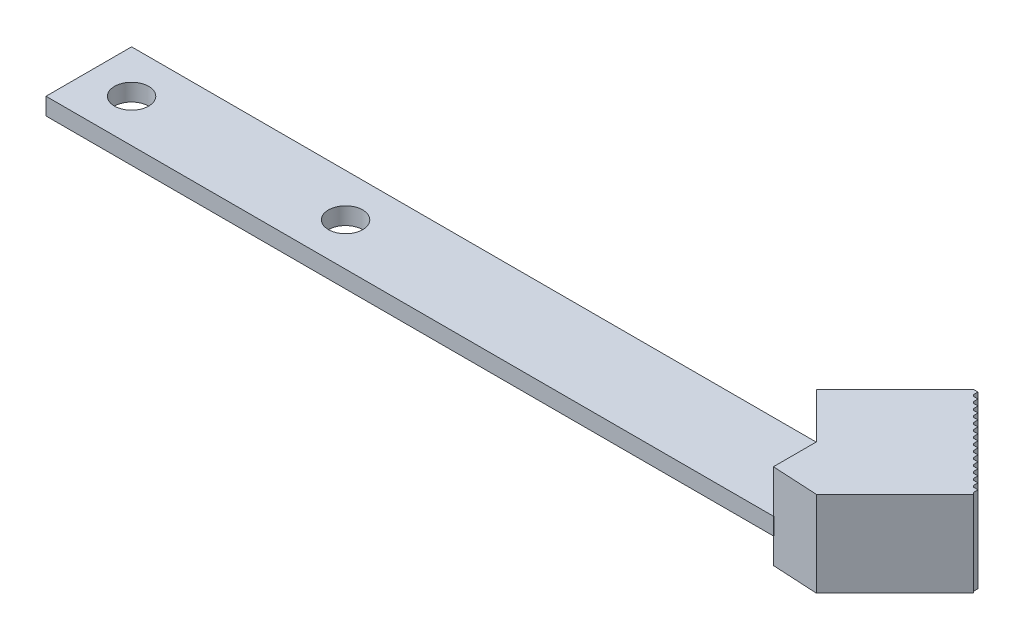
from build123d import *

# Parameters (mm, degrees)
SKETCH1_W           = 85
SKETCH1_H           = 10
SKETCH1_R           = 2
BOSS_EXTRUDE1_DEPTH = 2
CUT_EXTRUDE1_DEPTH  = 10
SKETCH3_W           = 15
SKETCH3_H           = 10
BOSS_EXTRUDE2_DEPTH = 13
BOSS_EXTRUDE3_DEPTH = 10
BOSS_EXTRUDE4_DEPTH = 10


with BuildPart() as part:
    # Sketch1 → Boss-Extrude1 (new body)
    with BuildSketch(Plane(origin=(0, 0, 0), x_dir=(1, 0, 0), z_dir=(0, 1, 0))):
        with Locations((18.270818553, 2.053936679)):
            Rectangle(SKETCH1_W, SKETCH1_H)
        with Locations(Location((-19.229181447, 2.053936679, 0), (0, 0, 270))):
            Circle(SKETCH1_R, mode=Mode.SUBTRACT)
        with Locations(Location((5.770818553, 2.053936679, 0), (0, 0, 270))):
            Circle(SKETCH1_R, mode=Mode.SUBTRACT)
    extrude(amount=BOSS_EXTRUDE1_DEPTH)

    # Sketch2 → Cut-Extrude1 (cut)
    with BuildSketch(Plane(origin=(0, 2, 0), x_dir=(1, 0, 0), z_dir=(0, 1, 0))):
        Polygon((55.770818553, 7.053936679), (60.770818553, 2.053936679), (60.770818553, 7.053936679), align=None)
    extrude(amount=-CUT_EXTRUDE1_DEPTH, mode=Mode.SUBTRACT)

    # Sketch3 → Boss-Extrude2 (add)
    with BuildSketch(Plane(origin=(31.412377616, 0, -31.412377616), x_dir=(-0.7071067811865488, 0, -0.7071067811865462), z_dir=(0.7071067811865462, 0, -0.7071067811865488))):
        with Locations((-41.420324571, 1.952612945)):
            Rectangle(SKETCH3_W, SKETCH3_H)
    extrude(amount=BOSS_EXTRUDE2_DEPTH)

    # Sketch4 → Boss-Extrude3 (add)
    with BuildSketch(Plane(origin=(0, 6.952612945, 0), x_dir=(1, 0, 0), z_dir=(0, 1, 0))):
        Polygon((60.70097, 2.123785233), (60.70097, -2.890998226), (66.004270859, -3.179515626), align=None)
    extrude(amount=-BOSS_EXTRUDE3_DEPTH)

    # Sketch6 → Boss-Extrude4 (add)
    with BuildSketch(Plane(origin=(0, 6.952612945, 0), x_dir=(1, 0, 0), z_dir=(0, 1, 0))):
        Polygon((64.590057296, 16.619474247), (65.090057296, 16.619474247), (65.090057296, 16.119474247), align=None)
        Polygon((65.297164077, 15.912367466), (65.797164077, 15.912367466), (65.797164077, 15.412367466), align=None)
        Polygon((66.004270859, 15.205260685), (66.504270859, 15.205260685), (66.504270859, 14.705260685), align=None)
        Polygon((66.71137764, 14.498153903), (67.21137764, 14.498153903), (67.21137764, 13.998153903), align=None)
        Polygon((67.418484421, 13.791047122), (67.918484421, 13.791047122), (67.918484421, 13.291047122), align=None)
        Polygon((68.125591202, 13.083940341), (68.625591202, 13.083940341), (68.625591202, 12.583940341), align=None)
        Polygon((68.832697983, 12.37683356), (69.332697983, 12.37683356), (69.332697983, 11.87683356), align=None)
        Polygon((69.539804764, 11.669726779), (70.039804764, 11.669726779), (70.039804764, 11.169726779), align=None)
        Polygon((70.246911546, 10.962619998), (70.746911546, 10.962619998), (70.746911546, 10.462619998), align=None)
        Polygon((70.954018327, 10.255513216), (71.454018327, 10.255513216), (71.454018327, 9.755513216), align=None)
        Polygon((71.661125108, 9.548406435), (72.161125108, 9.548406435), (72.161125108, 9.048406435), align=None)
        Polygon((72.368231889, 8.841299654), (72.868231889, 8.841299654), (72.868231889, 8.341299654), align=None)
        Polygon((73.07533867, 8.134192873), (73.57533867, 8.134192873), (73.57533867, 7.634192873), align=None)
        Polygon((73.782445452, 7.427086092), (74.282445452, 7.427086092), (74.282445452, 6.927086092), align=None)
        Polygon((74.489552233, 6.71997931), (74.989552233, 6.71997931), (74.989552233, 6.21997931), align=None)
    extrude(amount=-BOSS_EXTRUDE4_DEPTH)


solid = part.part
